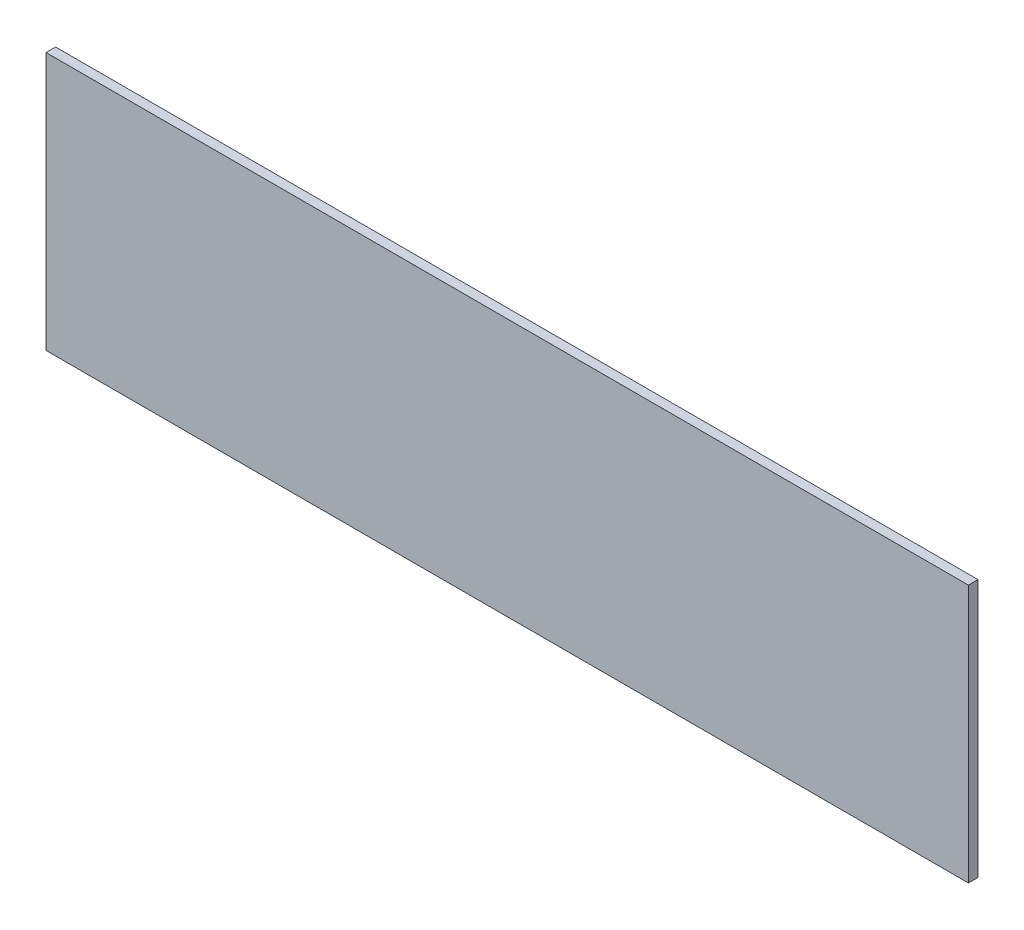
from build123d import *

# Parameters (mm, degrees)
SKETCH1_W           = 306.05
SKETCH1_H           = 85.6
BOSS_EXTRUDE1_DEPTH = 3.175


with BuildPart() as part:
    # Sketch1 → Boss-Extrude1 (new body)
    with BuildSketch(Plane.XY):
        Rectangle(SKETCH1_W, SKETCH1_H)
    extrude(amount=BOSS_EXTRUDE1_DEPTH)


solid = part.part
